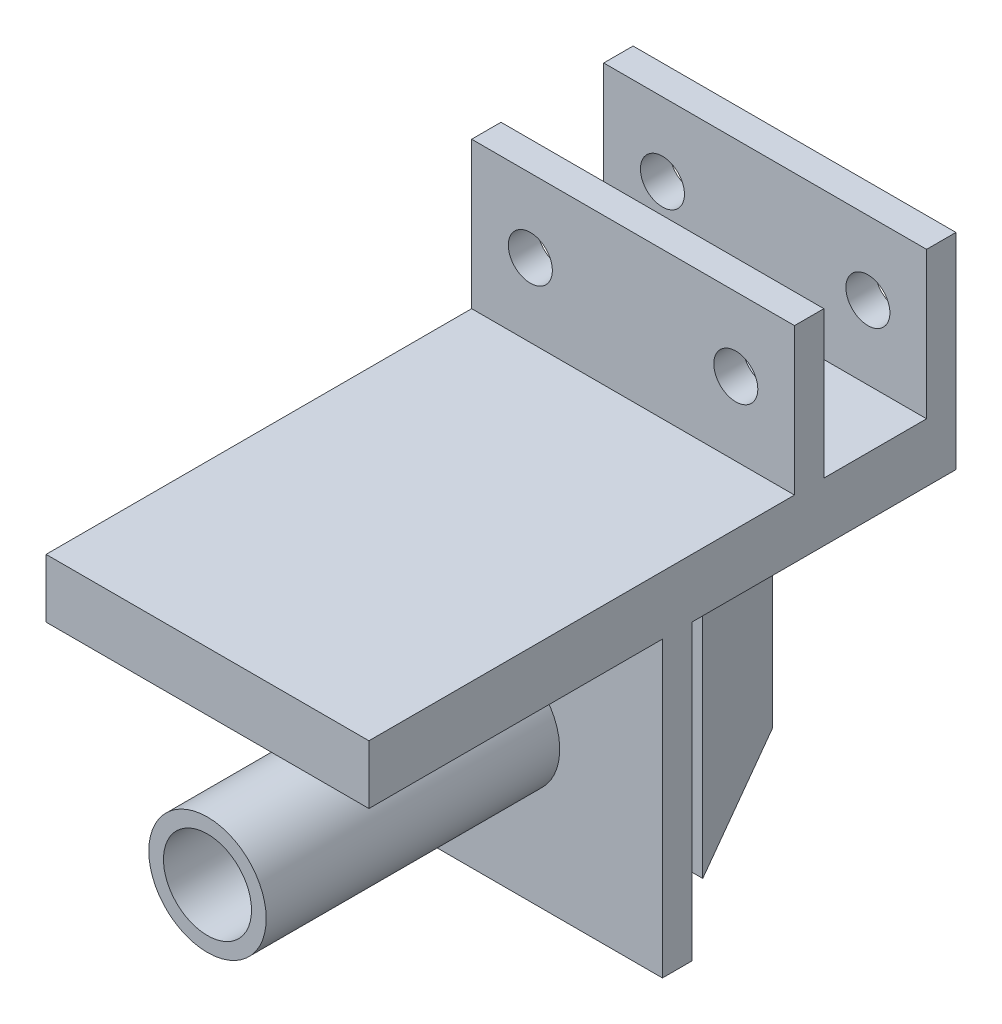
from build123d import *

# Parameters (mm, degrees)
SKETCH_2_W          = 22
SKETCH_2_H          = 40
EXTRUDE_1_DEPTH     = 4
SKETCH_3_W          = 22
SKETCH_3_H          = 2
EXTRUDE_2_DEPTH     = 10
SKETCH_4_R          = 1.5
CUT_EXTRUDE_1_DEPTH = 11
SKETCH_5_W          = 22
SKETCH_5_H          = 2
EXTRUDE_3_DEPTH     = 20
SKETCH_6_R          = 4
SKETCH_6_R_2        = 3
EXTRUDE_4_DEPTH     = 20
EXTRUDE_6_DEPTH     = 20


with BuildPart() as part:
    # Эскиз2 → Бобышка-Вытянуть1 (new body)
    with BuildSketch(Plane(origin=(0, 0, 0), x_dir=(1, 0, 0), z_dir=(0, 1, 0))):
        with Locations((-34.831985697, -10.44161698)):
            Rectangle(SKETCH_2_W, SKETCH_2_H)
    extrude(amount=EXTRUDE_1_DEPTH)

    # Эскиз3 → Бобышка-Вытянуть2 (add)
    with BuildSketch(Plane(origin=(0, 4, 0), x_dir=(1, 0, 0), z_dir=(0, 1, 0))):
        with Locations((-34.831985697, 8.55838302)):
            Rectangle(SKETCH_3_W, SKETCH_3_H)
        with Locations((-34.831985697, -0.44161698)):
            Rectangle(SKETCH_3_W, SKETCH_3_H)
    extrude(amount=EXTRUDE_2_DEPTH)

    # Эскиз4 → Вырез-Вытянуть1 (cut)
    with BuildSketch(Plane.XY.offset(1.44161698)):
        with Locations((-41.831985697, 9)):
            Circle(SKETCH_4_R)
        with Locations((-27.831985697, 9)):
            Circle(SKETCH_4_R)
    extrude(amount=-CUT_EXTRUDE_1_DEPTH, mode=Mode.SUBTRACT)

    # Эскиз5 → Бобышка-Вытянуть3 (add)
    with BuildSketch(Plane.XZ):
        with Locations((-34.831985697, 9.44161698)):
            Rectangle(SKETCH_5_W, SKETCH_5_H)
    extrude(amount=EXTRUDE_3_DEPTH)

    # Эскиз6 → Бобышка-Вытянуть4 (add)
    with BuildSketch(Plane.XY.offset(10.44161698)):
        with Locations(Location((-34.831985697, -10, 0), (0, 0, 180))):
            Circle(SKETCH_6_R)
        with Locations((-34.831985697, -10)):
            Circle(SKETCH_6_R_2, mode=Mode.SUBTRACT)
    extrude(amount=EXTRUDE_4_DEPTH)

    # Эскиз8 → Бобышка-Вытянуть6 (add)
    with BuildSketch(Plane.XZ):
        Polygon((-34.831985697, -8.063936519), (-28.331985697, 3.19439373), (-41.331985697, 3.19439373), align=None)
    extrude(amount=EXTRUDE_6_DEPTH)


solid = part.part
